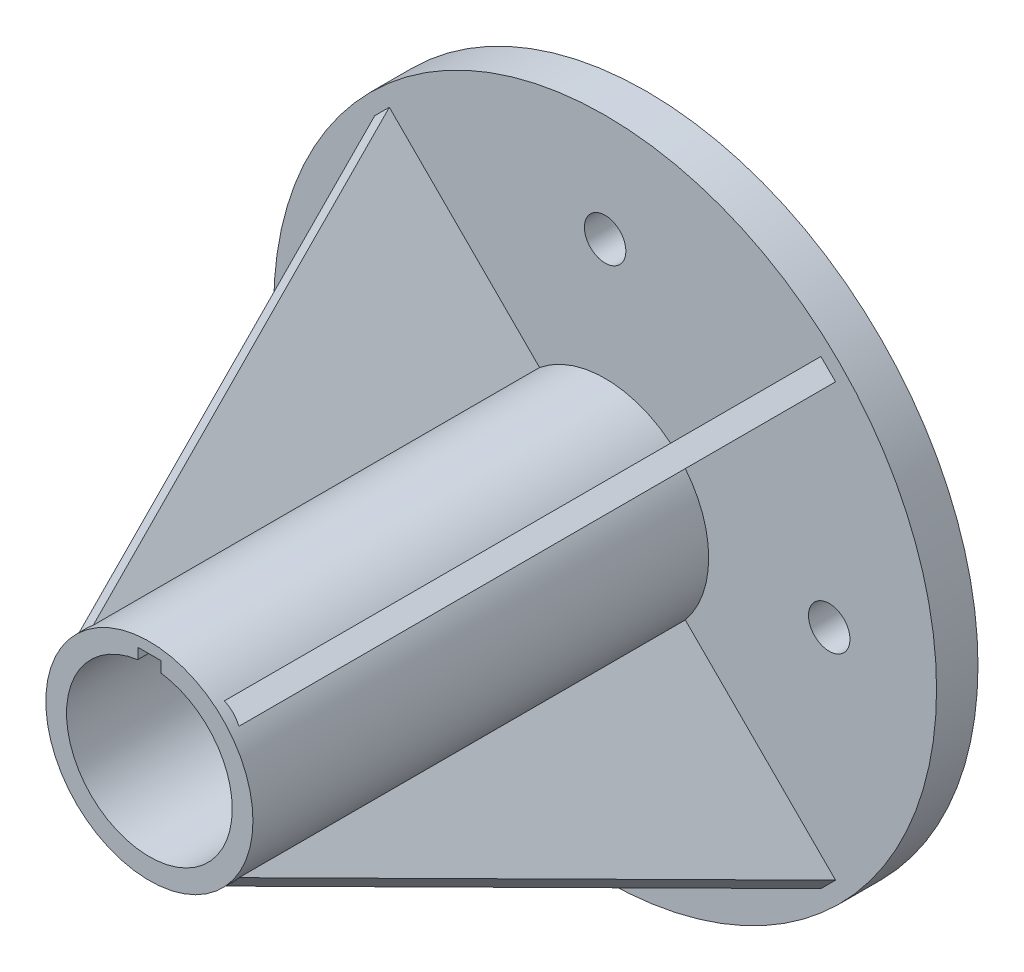
from build123d import *

# Parameters (mm, degrees)
SKETCH1_R         = 15.875
SKETCH1_R_2       = 12.7
EXTRUDE1_DEPTH    = 76.2
EXTRUDE2_DEPTH    = 25.4
EXTRUDE3_START    = 6.35
SKETCH3_R         = 50.8
SKETCH3_R_2       = 15.875
EXTRUDE3_DEPTH    = 6.35
SKETCH4_R         = 3.175
EXTRUDE5_DEPTH    = 7.62
RIB4_REACH        = 106.727
SKETCH6_WALL_W    = 287.037040946
SKETCH6_WALL_H    = 3.175
CIRPATTERN1_COUNT = 4


with BuildPart() as part:
    # Sketch1 → Extrude1 (new body)
    with BuildSketch(Plane.XY):
        Circle(SKETCH1_R)
        Circle(SKETCH1_R_2, mode=Mode.SUBTRACT)
    extrude(amount=-EXTRUDE1_DEPTH)

    # Sketch2 → Extrude2 (cut)
    with BuildSketch(Plane.XY):
        Polygon((1.778, 12.7), (1.778, 14.224), (-1.778, 14.224), (-1.778, 12.7), (-1.778, 12.361177694), (1.778, 12.361177694), align=None)
    extrude(amount=-EXTRUDE2_DEPTH, mode=Mode.SUBTRACT)

    # Sketch3 → Extrude3 (add)
    with BuildSketch(Plane.XY.offset(-76.2).offset(EXTRUDE3_START)):
        Circle(SKETCH3_R)
        Circle(SKETCH3_R_2, mode=Mode.SUBTRACT)
    extrude(amount=-EXTRUDE3_DEPTH)

    # Sketch4 → Extrude5 (cut)
    with BuildSketch(Plane.XY.offset(-76.2)):
        with Locations(Location((0, 34.350268622, 0), (0, 0, 180))):
            Circle(SKETCH4_R)
        with Locations(Location((34.350268622, 0, 0), (0, 0, 180))):
            Circle(SKETCH4_R)
        with Locations(Location((0, -34.350268622, 0), (0, 0, 180))):
            Circle(SKETCH4_R)
        with Locations(Location((-34.350268622, 0, 0), (0, 0, 180))):
            Circle(SKETCH4_R)
    extrude(amount=EXTRUDE5_DEPTH, mode=Mode.SUBTRACT)

    # Sketch6 wall → Rib4 (add, up to next)
    with BuildSketch(Plane(origin=(22.710403549, -22.710403549, -35.726788107), x_dir=(0.303905417501, -0.303905417501, -0.902930226777), z_dir=(-0.638468086292, 0.638468086292, -0.429787163108)), mode=Mode.PRIVATE) as rib4_sk1:
        Rectangle(SKETCH6_WALL_W, SKETCH6_WALL_H)
    rib4_tool1 = extrude(rib4_sk1.sketch, amount=RIB4_REACH, mode=Mode.PRIVATE) - part.part
    rib4 = rib4_tool1.solids().sort_by_distance((22.710403549, -22.710403549, -35.726788107))[0]
    add(rib4)

    # CirPattern1: Rib4 ×4 about axis
    cirpattern1_axis = Axis((0, 0, 0), (0, 0, 1))
    for i in range(1, CIRPATTERN1_COUNT):
        add(rib4.rotate(cirpattern1_axis, i * 360 / CIRPATTERN1_COUNT))


solid = part.part
